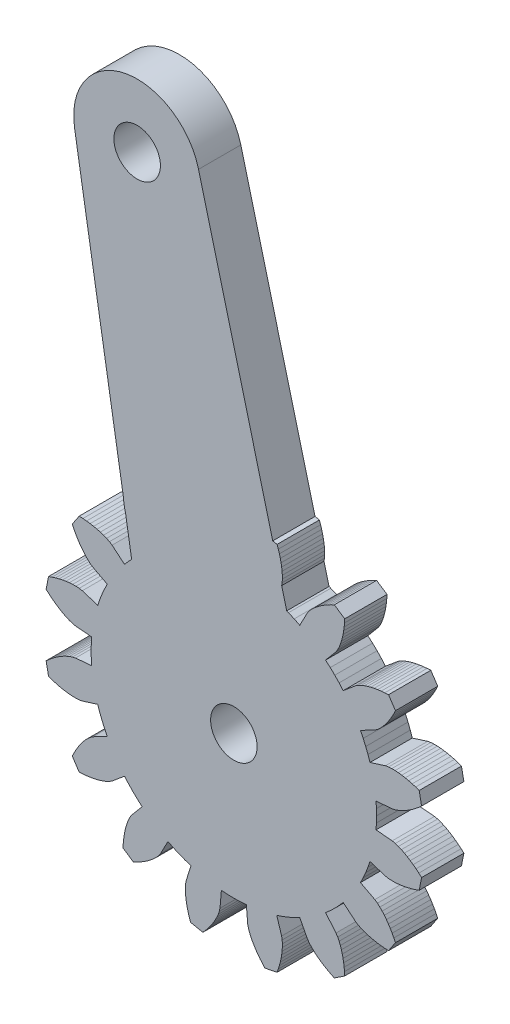
from build123d import *

# Parameters (mm, degrees)
PLASTINA_DEPTH        = 3
OTVERSTIYA_DEPTH      = 45.752454454
OTVERSTIYA_DEPTH_BACK = 45.752454454
ESKIZ_OTVERSTIYA_R    = 1.65


with BuildPart() as part:
    # Eskiz_kontur → Plastina (new body)
    with BuildSketch(Plane.XY):
        with BuildLine():
            Line((-1.91368, 0.88417), (-1.88467, 0.44251))
            Line((-1.88467, 0.44251), (-1.875, 0))
            Line((-1.875, 0), (-1.88467, -0.44251))
            Line((-1.88467, -0.44251), (-1.91368, -0.88417))
            Line((-1.91368, -0.88417), (-0.76677, -0.98471))
            Line((-0.76677, -0.98471), (-0.54788, -1.03377))
            Line((-0.54788, -1.03377), (-0.33146, -1.10826))
            Line((-0.33146, -1.10826), (-0.11703, -1.20015))
            Line((-0.11703, -1.20015), (0.0954, -1.30676))
            Line((0.0954, -1.30676), (0.30574, -1.42659))
            Line((0.30574, -1.42659), (0.51383, -1.55867))
            Line((0.51383, -1.55867), (0.71949, -1.70231))
            Line((0.71949, -1.70231), (0.92252, -1.85698))
            Line((0.92252, -1.85698), (1.12272, -2.02228))
            Line((1.12272, -2.02228), (1.31989, -2.19787))
            Line((1.31989, -2.19787), (1.14706, -3.06674))
            Line((1.14706, -3.06674), (0.89771, -3.1535))
            Line((0.89771, -3.1535), (0.64949, -3.2296))
            Line((0.64949, -3.2296), (0.40272, -3.29481))
            Line((0.40272, -3.29481), (0.15775, -3.34881))
            Line((0.15775, -3.34881), (-0.08505, -3.39121))
            Line((-0.08505, -3.39121), (-0.32523, -3.42142))
            Line((-0.32523, -3.42142), (-0.56229, -3.43862))
            Line((-0.56229, -3.43862), (-0.79557, -3.44146))
            Line((-0.79557, -3.44146), (-1.02402, -3.42745))
            Line((-1.02402, -3.42745), (-1.24501, -3.38902))
            Line((-1.24501, -3.38902), (-2.3431, -3.043))
            Line((-2.3431, -3.043), (-2.48532, -3.46214))
            Line((-2.48532, -3.46214), (-2.64572, -3.87467))
            Line((-2.64572, -3.87467), (-2.824, -4.27979))
            Line((-2.824, -4.27979), (-3.01981, -4.67674))
            Line((-3.01981, -4.67674), (-1.99868, -5.20853))
            Line((-1.99868, -5.20853), (-1.81523, -5.33762))
            Line((-1.81523, -5.33762), (-1.64379, -5.48925))
            Line((-1.64379, -5.48925), (-1.48085, -5.65621))
            Line((-1.48085, -5.65621), (-1.32538, -5.836))
            Line((-1.32538, -5.836), (-1.17691, -6.0272))
            Line((-1.17691, -6.0272), (-1.03521, -6.22886))
            Line((-1.03521, -6.22886), (-0.90017, -6.44026))
            Line((-0.90017, -6.44026), (-0.77179, -6.66086))
            Line((-0.77179, -6.66086), (-0.65008, -6.8902))
            Line((-0.65008, -6.8902), (-0.53512, -7.12786))
            Line((-0.53512, -7.12786), (-1.02729, -7.86446))
            Line((-1.02729, -7.86446), (-1.29086, -7.8492))
            Line((-1.29086, -7.8492), (-1.54931, -7.82451))
            Line((-1.54931, -7.82451), (-1.80225, -7.79032))
            Line((-1.80225, -7.79032), (-2.04924, -7.74647))
            Line((-2.04924, -7.74647), (-2.28978, -7.69272))
            Line((-2.28978, -7.69272), (-2.52324, -7.62872))
            Line((-2.52324, -7.62872), (-2.74884, -7.55389))
            Line((-2.74884, -7.55389), (-2.96544, -7.46725))
            Line((-2.96544, -7.46725), (-3.17114, -7.36688))
            Line((-3.17114, -7.36688), (-3.36061, -7.2468))
            Line((-3.36061, -7.2468), (-4.24269, -6.5069))
            Line((-4.24269, -6.5069), (-4.53448, -6.83971))
            Line((-4.53448, -6.83971), (-4.84054, -7.15946))
            Line((-4.84054, -7.15946), (-5.16029, -7.46552))
            Line((-5.16029, -7.46552), (-5.4931, -7.75731))
            Line((-5.4931, -7.75731), (-4.7532, -8.63939))
            Line((-4.7532, -8.63939), (-4.63312, -8.82886))
            Line((-4.63312, -8.82886), (-4.53275, -9.03456))
            Line((-4.53275, -9.03456), (-4.44611, -9.25116))
            Line((-4.44611, -9.25116), (-4.37128, -9.47676))
            Line((-4.37128, -9.47676), (-4.30728, -9.71022))
            Line((-4.30728, -9.71022), (-4.25353, -9.95076))
            Line((-4.25353, -9.95076), (-4.20968, -10.19775))
            Line((-4.20968, -10.19775), (-4.17549, -10.45069))
            Line((-4.17549, -10.45069), (-4.1508, -10.70914))
            Line((-4.1508, -10.70914), (-4.13554, -10.97271))
            Line((-4.13554, -10.97271), (-4.87214, -11.46488))
            Line((-4.87214, -11.46488), (-5.1098, -11.34992))
            Line((-5.1098, -11.34992), (-5.33914, -11.22821))
            Line((-5.33914, -11.22821), (-5.55974, -11.09983))
            Line((-5.55974, -11.09983), (-5.77114, -10.96479))
            Line((-5.77114, -10.96479), (-5.9728, -10.82309))
            Line((-5.9728, -10.82309), (-6.164, -10.67462))
            Line((-6.164, -10.67462), (-6.34379, -10.51915))
            Line((-6.34379, -10.51915), (-6.51075, -10.35621))
            Line((-6.51075, -10.35621), (-6.66238, -10.18477))
            Line((-6.66238, -10.18477), (-6.79147, -10.00132))
            Line((-6.79147, -10.00132), (-7.32326, -8.98019))
            Line((-7.32326, -8.98019), (-7.72021, -9.176))
            Line((-7.72021, -9.176), (-8.12533, -9.35428))
            Line((-8.12533, -9.35428), (-8.53786, -9.51468))
            Line((-8.53786, -9.51468), (-8.957, -9.6569))
            Line((-8.957, -9.6569), (-8.61098, -10.75499))
            Line((-8.61098, -10.75499), (-8.57255, -10.97598))
            Line((-8.57255, -10.97598), (-8.55854, -11.20443))
            Line((-8.55854, -11.20443), (-8.56138, -11.43771))
            Line((-8.56138, -11.43771), (-8.57858, -11.67477))
            Line((-8.57858, -11.67477), (-8.60879, -11.91495))
            Line((-8.60879, -11.91495), (-8.65119, -12.15775))
            Line((-8.65119, -12.15775), (-8.70519, -12.40272))
            Line((-8.70519, -12.40272), (-8.7704, -12.64949))
            Line((-8.7704, -12.64949), (-8.8465, -12.89771))
            Line((-8.8465, -12.89771), (-8.93326, -13.14706))
            Line((-8.93326, -13.14706), (-9.80213, -13.31989))
            Line((-9.80213, -13.31989), (-9.97772, -13.12272))
            Line((-9.97772, -13.12272), (-10.14302, -12.92252))
            Line((-10.14302, -12.92252), (-10.29769, -12.71949))
            Line((-10.29769, -12.71949), (-10.44133, -12.51383))
            Line((-10.44133, -12.51383), (-10.57341, -12.30574))
            Line((-10.57341, -12.30574), (-10.69324, -12.0954))
            Line((-10.69324, -12.0954), (-10.79985, -11.88297))
            Line((-10.79985, -11.88297), (-10.89174, -11.66854))
            Line((-10.89174, -11.66854), (-10.96623, -11.45212))
            Line((-10.96623, -11.45212), (-11.01529, -11.23323))
            Line((-11.01529, -11.23323), (-11.11583, -10.08632))
            Line((-11.11583, -10.08632), (-11.55749, -10.11533))
            Line((-11.55749, -10.11533), (-12, -10.125))
            Line((-12, -10.125), (-12.44251, -10.11533))
            Line((-12.44251, -10.11533), (-12.88417, -10.08632))
            Line((-12.88417, -10.08632), (-12.98471, -11.23323))
            Line((-12.98471, -11.23323), (-13.03377, -11.45212))
            Line((-13.03377, -11.45212), (-13.10826, -11.66854))
            Line((-13.10826, -11.66854), (-13.20015, -11.88297))
            Line((-13.20015, -11.88297), (-13.30676, -12.0954))
            Line((-13.30676, -12.0954), (-13.42659, -12.30574))
            Line((-13.42659, -12.30574), (-13.55867, -12.51383))
            Line((-13.55867, -12.51383), (-13.70231, -12.71949))
            Line((-13.70231, -12.71949), (-13.85698, -12.92252))
            Line((-13.85698, -12.92252), (-14.02228, -13.12272))
            Line((-14.02228, -13.12272), (-14.19787, -13.31989))
            Line((-14.19787, -13.31989), (-15.06674, -13.14706))
            Line((-15.06674, -13.14706), (-15.1535, -12.89771))
            Line((-15.1535, -12.89771), (-15.2296, -12.64949))
            Line((-15.2296, -12.64949), (-15.29481, -12.40272))
            Line((-15.29481, -12.40272), (-15.34881, -12.15775))
            Line((-15.34881, -12.15775), (-15.39121, -11.91495))
            Line((-15.39121, -11.91495), (-15.42142, -11.67477))
            Line((-15.42142, -11.67477), (-15.43862, -11.43771))
            Line((-15.43862, -11.43771), (-15.44146, -11.20443))
            Line((-15.44146, -11.20443), (-15.42745, -10.97598))
            Line((-15.42745, -10.97598), (-15.38902, -10.75499))
            Line((-15.38902, -10.75499), (-15.043, -9.6569))
            Line((-15.043, -9.6569), (-15.46214, -9.51468))
            Line((-15.46214, -9.51468), (-15.87467, -9.35428))
            Line((-15.87467, -9.35428), (-16.27979, -9.176))
            Line((-16.27979, -9.176), (-16.67674, -8.98019))
            Line((-16.67674, -8.98019), (-17.20853, -10.00132))
            Line((-17.20853, -10.00132), (-17.33762, -10.18477))
            Line((-17.33762, -10.18477), (-17.48925, -10.35621))
            Line((-17.48925, -10.35621), (-17.65621, -10.51915))
            Line((-17.65621, -10.51915), (-17.836, -10.67462))
            Line((-17.836, -10.67462), (-18.0272, -10.82309))
            Line((-18.0272, -10.82309), (-18.22886, -10.96479))
            Line((-18.22886, -10.96479), (-18.44026, -11.09983))
            Line((-18.44026, -11.09983), (-18.66086, -11.22821))
            Line((-18.66086, -11.22821), (-18.8902, -11.34992))
            Line((-18.8902, -11.34992), (-19.12786, -11.46488))
            Line((-19.12786, -11.46488), (-19.86446, -10.97271))
            Line((-19.86446, -10.97271), (-19.8492, -10.70914))
            Line((-19.8492, -10.70914), (-19.82451, -10.45069))
            Line((-19.82451, -10.45069), (-19.79032, -10.19775))
            Line((-19.79032, -10.19775), (-19.74647, -9.95076))
            Line((-19.74647, -9.95076), (-19.69272, -9.71022))
            Line((-19.69272, -9.71022), (-19.62872, -9.47676))
            Line((-19.62872, -9.47676), (-19.55389, -9.25116))
            Line((-19.55389, -9.25116), (-19.46725, -9.03456))
            Line((-19.46725, -9.03456), (-19.36688, -8.82886))
            Line((-19.36688, -8.82886), (-19.2468, -8.63939))
            Line((-19.2468, -8.63939), (-18.5069, -7.75731))
            Line((-18.5069, -7.75731), (-18.83971, -7.46552))
            Line((-18.83971, -7.46552), (-19.15946, -7.15946))
            Line((-19.15946, -7.15946), (-19.46552, -6.83971))
            Line((-19.46552, -6.83971), (-19.75731, -6.5069))
            Line((-19.75731, -6.5069), (-20.63939, -7.2468))
            Line((-20.63939, -7.2468), (-20.82886, -7.36688))
            Line((-20.82886, -7.36688), (-21.03456, -7.46725))
            Line((-21.03456, -7.46725), (-21.25116, -7.55389))
            Line((-21.25116, -7.55389), (-21.47676, -7.62872))
            Line((-21.47676, -7.62872), (-21.71022, -7.69272))
            Line((-21.71022, -7.69272), (-21.95076, -7.74647))
            Line((-21.95076, -7.74647), (-22.19775, -7.79032))
            Line((-22.19775, -7.79032), (-22.45069, -7.82451))
            Line((-22.45069, -7.82451), (-22.70914, -7.8492))
            Line((-22.70914, -7.8492), (-22.97271, -7.86446))
            Line((-22.97271, -7.86446), (-23.46488, -7.12786))
            Line((-23.46488, -7.12786), (-23.34992, -6.8902))
            Line((-23.34992, -6.8902), (-23.22821, -6.66086))
            Line((-23.22821, -6.66086), (-23.09983, -6.44026))
            Line((-23.09983, -6.44026), (-22.96479, -6.22886))
            Line((-22.96479, -6.22886), (-22.82309, -6.0272))
            Line((-22.82309, -6.0272), (-22.67462, -5.836))
            Line((-22.67462, -5.836), (-22.51915, -5.65621))
            Line((-22.51915, -5.65621), (-22.35621, -5.48925))
            Line((-22.35621, -5.48925), (-22.18477, -5.33762))
            Line((-22.18477, -5.33762), (-22.00132, -5.20853))
            Line((-22.00132, -5.20853), (-20.98019, -4.67674))
            Line((-20.98019, -4.67674), (-21.176, -4.27979))
            Line((-21.176, -4.27979), (-21.35428, -3.87467))
            Line((-21.35428, -3.87467), (-21.51468, -3.46214))
            Line((-21.51468, -3.46214), (-21.6569, -3.043))
            Line((-21.6569, -3.043), (-22.75499, -3.38902))
            Line((-22.75499, -3.38902), (-22.97598, -3.42745))
            Line((-22.97598, -3.42745), (-23.20443, -3.44146))
            Line((-23.20443, -3.44146), (-23.43771, -3.43862))
            Line((-23.43771, -3.43862), (-23.67477, -3.42142))
            Line((-23.67477, -3.42142), (-23.91495, -3.39121))
            Line((-23.91495, -3.39121), (-24.15775, -3.34881))
            Line((-24.15775, -3.34881), (-24.40272, -3.29481))
            Line((-24.40272, -3.29481), (-24.64949, -3.2296))
            Line((-24.64949, -3.2296), (-24.89771, -3.1535))
            Line((-24.89771, -3.1535), (-25.14706, -3.06674))
            Line((-25.14706, -3.06674), (-25.31989, -2.19787))
            Line((-25.31989, -2.19787), (-25.12272, -2.02228))
            Line((-25.12272, -2.02228), (-24.92252, -1.85698))
            Line((-24.92252, -1.85698), (-24.71949, -1.70231))
            Line((-24.71949, -1.70231), (-24.51383, -1.55867))
            Line((-24.51383, -1.55867), (-24.30574, -1.42659))
            Line((-24.30574, -1.42659), (-24.0954, -1.30676))
            Line((-24.0954, -1.30676), (-23.88297, -1.20015))
            Line((-23.88297, -1.20015), (-23.66854, -1.10826))
            Line((-23.66854, -1.10826), (-23.45212, -1.03377))
            Line((-23.45212, -1.03377), (-23.23323, -0.98471))
            Line((-23.23323, -0.98471), (-22.08632, -0.88417))
            Line((-22.08632, -0.88417), (-22.11533, -0.44251))
            Line((-22.11533, -0.44251), (-22.125, 0))
            Line((-22.125, 0), (-22.11533, 0.44251))
            Line((-22.11533, 0.44251), (-22.08632, 0.88417))
            Line((-22.08632, 0.88417), (-23.23323, 0.98471))
            Line((-23.23323, 0.98471), (-23.45212, 1.03377))
            Line((-23.45212, 1.03377), (-23.66854, 1.10826))
            Line((-23.66854, 1.10826), (-23.88297, 1.20015))
            Line((-23.88297, 1.20015), (-24.0954, 1.30676))
            Line((-24.0954, 1.30676), (-24.30574, 1.42659))
            Line((-24.30574, 1.42659), (-24.51383, 1.55867))
            Line((-24.51383, 1.55867), (-24.71949, 1.70231))
            Line((-24.71949, 1.70231), (-24.92252, 1.85698))
            Line((-24.92252, 1.85698), (-25.12272, 2.02228))
            Line((-25.12272, 2.02228), (-25.31989, 2.19787))
            Line((-25.31989, 2.19787), (-25.14706, 3.06674))
            Line((-25.14706, 3.06674), (-24.89771, 3.1535))
            Line((-24.89771, 3.1535), (-24.64949, 3.2296))
            Line((-24.64949, 3.2296), (-24.40272, 3.29481))
            Line((-24.40272, 3.29481), (-24.15775, 3.34881))
            Line((-24.15775, 3.34881), (-23.91495, 3.39121))
            Line((-23.91495, 3.39121), (-23.67477, 3.42142))
            Line((-23.67477, 3.42142), (-23.43771, 3.43862))
            Line((-23.43771, 3.43862), (-23.20443, 3.44146))
            Line((-23.20443, 3.44146), (-22.97598, 3.42745))
            Line((-22.97598, 3.42745), (-22.75499, 3.38902))
            Line((-22.75499, 3.38902), (-21.6569, 3.043))
            Line((-21.6569, 3.043), (-21.51468, 3.46214))
            Line((-21.51468, 3.46214), (-21.35428, 3.87467))
            Line((-21.35428, 3.87467), (-21.176, 4.27979))
            Line((-21.176, 4.27979), (-20.98019, 4.67674))
            Line((-20.98019, 4.67674), (-22.00132, 5.20853))
            Line((-22.00132, 5.20853), (-22.18477, 5.33762))
            Line((-22.18477, 5.33762), (-22.35621, 5.48925))
            Line((-22.35621, 5.48925), (-22.51915, 5.65621))
            Line((-22.51915, 5.65621), (-22.67462, 5.836))
            Line((-22.67462, 5.836), (-22.82309, 6.0272))
            Line((-22.82309, 6.0272), (-22.96479, 6.22886))
            Line((-22.96479, 6.22886), (-23.09983, 6.44026))
            Line((-23.09983, 6.44026), (-23.22821, 6.66086))
            Line((-23.22821, 6.66086), (-23.34992, 6.8902))
            Line((-23.34992, 6.8902), (-23.46488, 7.12786))
            Line((-23.46488, 7.12786), (-22.97271, 7.86446))
            Line((-22.97271, 7.86446), (-22.70914, 7.8492))
            Line((-22.70914, 7.8492), (-22.45069, 7.82451))
            Line((-22.45069, 7.82451), (-22.19775, 7.79032))
            Line((-22.19775, 7.79032), (-21.95076, 7.74647))
            Line((-21.95076, 7.74647), (-21.71022, 7.69272))
            Line((-21.71022, 7.69272), (-21.47676, 7.62872))
            Line((-21.47676, 7.62872), (-21.25116, 7.55389))
            Line((-21.25116, 7.55389), (-21.03456, 7.46725))
            Line((-21.03456, 7.46725), (-20.82886, 7.36688))
            Line((-20.82886, 7.36688), (-20.63939, 7.2468))
            Line((-20.63939, 7.2468), (-19.75731, 6.5069))
            Line((-19.75731, 6.5069), (-19.46552, 6.83971))
            Line((-19.46552, 6.83971), (-19.25041, 7.06444))
            Line((-19.25041, 7.06444), (-19.68123, 9.66829))
            Line((-19.68123, 9.66829), (-19.69272, 9.71022))
            Line((-19.69272, 9.71022), (-19.74647, 9.95076))
            Line((-19.74647, 9.95076), (-19.79032, 10.19775))
            Line((-19.79032, 10.19775), (-19.82451, 10.45069))
            Line((-19.82451, 10.45069), (-19.8434, 10.64847))
            Line((-19.8434, 10.64847), (-23.29937, 31.53616))
            ThreePointArc((-23.29937, 31.53616), (-19.796684977, 36.680535622), (-14.50442, 33.40558))
            Line((-14.50442, 33.40558), (-9.24146, 13.20836))
            Line((-9.24146, 13.20836), (-8.93326, 13.14706))
            Line((-8.93326, 13.14706), (-8.8465, 12.89771))
            Line((-8.8465, 12.89771), (-8.7704, 12.64949))
            Line((-8.7704, 12.64949), (-8.70519, 12.40272))
            Line((-8.70519, 12.40272), (-8.65119, 12.15775))
            Line((-8.65119, 12.15775), (-8.60879, 11.91495))
            Line((-8.60879, 11.91495), (-8.57858, 11.67477))
            Line((-8.57858, 11.67477), (-8.56138, 11.43771))
            Line((-8.56138, 11.43771), (-8.55854, 11.20443))
            Line((-8.55854, 11.20443), (-8.57255, 10.97598))
            Line((-8.57255, 10.97598), (-8.60745, 10.77527))
            Line((-8.60745, 10.77527), (-8.24978, 9.40267))
            Line((-8.24978, 9.40267), (-8.12533, 9.35428))
            Line((-8.12533, 9.35428), (-7.72021, 9.176))
            Line((-7.72021, 9.176), (-7.32326, 8.98019))
            Line((-7.32326, 8.98019), (-6.79147, 10.00132))
            Line((-6.79147, 10.00132), (-6.66238, 10.18477))
            Line((-6.66238, 10.18477), (-6.51075, 10.35621))
            Line((-6.51075, 10.35621), (-6.34379, 10.51915))
            Line((-6.34379, 10.51915), (-6.164, 10.67462))
            Line((-6.164, 10.67462), (-5.9728, 10.82309))
            Line((-5.9728, 10.82309), (-5.77114, 10.96479))
            Line((-5.77114, 10.96479), (-5.55974, 11.09983))
            Line((-5.55974, 11.09983), (-5.33914, 11.22821))
            Line((-5.33914, 11.22821), (-5.1098, 11.34992))
            Line((-5.1098, 11.34992), (-4.87214, 11.46488))
            Line((-4.87214, 11.46488), (-4.13554, 10.97271))
            Line((-4.13554, 10.97271), (-4.1508, 10.70914))
            Line((-4.1508, 10.70914), (-4.17549, 10.45069))
            Line((-4.17549, 10.45069), (-4.20968, 10.19775))
            Line((-4.20968, 10.19775), (-4.25353, 9.95076))
            Line((-4.25353, 9.95076), (-4.30728, 9.71022))
            Line((-4.30728, 9.71022), (-4.37128, 9.47676))
            Line((-4.37128, 9.47676), (-4.44611, 9.25116))
            Line((-4.44611, 9.25116), (-4.53275, 9.03456))
            Line((-4.53275, 9.03456), (-4.63312, 8.82886))
            Line((-4.63312, 8.82886), (-4.7532, 8.63939))
            Line((-4.7532, 8.63939), (-5.4931, 7.75731))
            Line((-5.4931, 7.75731), (-5.16029, 7.46552))
            Line((-5.16029, 7.46552), (-4.84054, 7.15946))
            Line((-4.84054, 7.15946), (-4.53448, 6.83971))
            Line((-4.53448, 6.83971), (-4.24269, 6.5069))
            Line((-4.24269, 6.5069), (-3.36061, 7.2468))
            Line((-3.36061, 7.2468), (-3.17114, 7.36688))
            Line((-3.17114, 7.36688), (-2.96544, 7.46725))
            Line((-2.96544, 7.46725), (-2.74884, 7.55389))
            Line((-2.74884, 7.55389), (-2.52324, 7.62872))
            Line((-2.52324, 7.62872), (-2.28978, 7.69272))
            Line((-2.28978, 7.69272), (-2.04924, 7.74647))
            Line((-2.04924, 7.74647), (-1.80225, 7.79032))
            Line((-1.80225, 7.79032), (-1.54931, 7.82451))
            Line((-1.54931, 7.82451), (-1.29086, 7.8492))
            Line((-1.29086, 7.8492), (-1.02729, 7.86446))
            Line((-1.02729, 7.86446), (-0.53512, 7.12786))
            Line((-0.53512, 7.12786), (-0.65008, 6.8902))
            Line((-0.65008, 6.8902), (-0.77179, 6.66086))
            Line((-0.77179, 6.66086), (-0.90017, 6.44026))
            Line((-0.90017, 6.44026), (-1.03521, 6.22886))
            Line((-1.03521, 6.22886), (-1.17691, 6.0272))
            Line((-1.17691, 6.0272), (-1.32538, 5.836))
            Line((-1.32538, 5.836), (-1.48085, 5.65621))
            Line((-1.48085, 5.65621), (-1.64379, 5.48925))
            Line((-1.64379, 5.48925), (-1.81523, 5.33762))
            Line((-1.81523, 5.33762), (-1.99868, 5.20853))
            Line((-1.99868, 5.20853), (-3.01981, 4.67674))
            Line((-3.01981, 4.67674), (-2.824, 4.27979))
            Line((-2.824, 4.27979), (-2.64572, 3.87467))
            Line((-2.64572, 3.87467), (-2.48532, 3.46214))
            Line((-2.48532, 3.46214), (-2.3431, 3.043))
            Line((-2.3431, 3.043), (-1.24501, 3.38902))
            Line((-1.24501, 3.38902), (-1.02402, 3.42745))
            Line((-1.02402, 3.42745), (-0.79557, 3.44146))
            Line((-0.79557, 3.44146), (-0.56229, 3.43862))
            Line((-0.56229, 3.43862), (-0.32523, 3.42142))
            Line((-0.32523, 3.42142), (-0.08505, 3.39121))
            Line((-0.08505, 3.39121), (0.15775, 3.34881))
            Line((0.15775, 3.34881), (0.40272, 3.29481))
            Line((0.40272, 3.29481), (0.64949, 3.2296))
            Line((0.64949, 3.2296), (0.89771, 3.1535))
            Line((0.89771, 3.1535), (1.14706, 3.06674))
            Line((1.14706, 3.06674), (1.31989, 2.19787))
            Line((1.31989, 2.19787), (1.12272, 2.02228))
            Line((1.12272, 2.02228), (0.92252, 1.85698))
            Line((0.92252, 1.85698), (0.71949, 1.70231))
            Line((0.71949, 1.70231), (0.51383, 1.55867))
            Line((0.51383, 1.55867), (0.30574, 1.42659))
            Line((0.30574, 1.42659), (0.0954, 1.30676))
            Line((0.0954, 1.30676), (-0.11703, 1.20015))
            Line((-0.11703, 1.20015), (-0.33146, 1.10826))
            Line((-0.33146, 1.10826), (-0.54788, 1.03377))
            Line((-0.54788, 1.03377), (-0.76677, 0.98471))
            Line((-0.76677, 0.98471), (-1.91368, 0.88417))
        make_face()
    extrude(amount=PLASTINA_DEPTH)

    # Eskiz_otverstiya → Otverstiya (cut, two sides: drawn at the far end of the back side and taken through both)
    with BuildSketch(Plane.XY.offset(-OTVERSTIYA_DEPTH_BACK)):
        with Locations((-12, 0)):
            Circle(ESKIZ_OTVERSTIYA_R)
        with Locations((-18.86109, 32.27887)):
            Circle(ESKIZ_OTVERSTIYA_R)
    extrude(amount=OTVERSTIYA_DEPTH + OTVERSTIYA_DEPTH_BACK, mode=Mode.SUBTRACT)


solid = part.part
